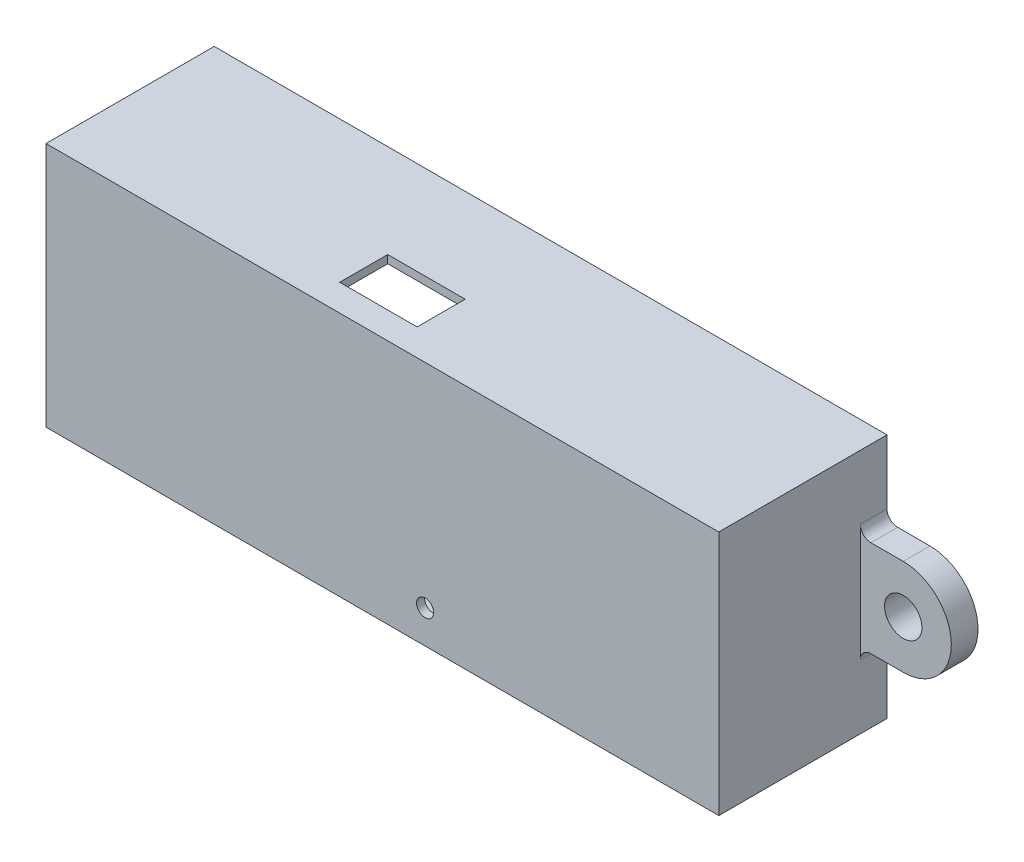
from build123d import *

# Parameters (mm, degrees)
SKETCH_1_W           = 123
SKETCH_1_H           = 43
EXTRUDE_1_DEPTH      = 1.5
EXTRUDE_2_DEPTH      = 30
EXTRUDE_2_DEPTH_BACK = 1.5
SKETCH_2_W           = 126
SKETCH_2_H           = 46
SKETCH_2_W_2         = 123
SKETCH_2_H_2         = 43
SKETCH_3_R           = 3.5
EXTRUDE_3_DEPTH      = 5
SKETCH_5_R           = 1.6
CUT_EXTRUDE_1_DEPTH  = 10
CUT_EXTRUDE_2_DEPTH  = 10
SKETCH_7_W           = 14.5
SKETCH_7_H           = 9
CUT_EXTRUDE_3_DEPTH  = 10
FILLET_1_R           = 2


with BuildPart() as part:
    # Эскиз1 → Бобышка-Вытянуть1 (new body)
    with BuildSketch(Plane.XY):
        with Locations((61.5, 21.5)):
            Rectangle(SKETCH_1_W, SKETCH_1_H)
    extrude(amount=EXTRUDE_1_DEPTH)

    # Эскиз2 → Бобышка-Вытянуть2 (add, two sides: drawn at the far end of the back side and taken through both)
    with BuildSketch(Plane(origin=(0, 0, 0), x_dir=(-1, 0, 0), z_dir=(0, 0, -1)).offset(-EXTRUDE_2_DEPTH_BACK)):
        with Locations((-61.5, 21.5)):
            Rectangle(SKETCH_2_W, SKETCH_2_H)
        with Locations((-61.5, 21.5)):
            Rectangle(SKETCH_2_W_2, SKETCH_2_H_2, mode=Mode.SUBTRACT)
    extrude(amount=EXTRUDE_2_DEPTH + EXTRUDE_2_DEPTH_BACK)

    # Эскиз3 → Бобышка-Вытянуть3 (add)
    with BuildSketch(Plane(origin=(0, 0, -30), x_dir=(-1, 0, 0), z_dir=(0, 0, -1))):
        with BuildLine():
            Line((-124.5, 12.5), (-132.54002612, 12.5))
            ThreePointArc((-132.54002612, 12.5), (-141.54002612, 21.5), (-132.54002612, 30.5))
            Line((-132.54002612, 30.5), (-124.5, 30.5))
            Line((-124.5, 30.5), (-124.5, 12.5))
        make_face()
        with Locations((-132.54002612, 21.5)):
            Circle(SKETCH_3_R, mode=Mode.SUBTRACT)
    extrude_3 = extrude(amount=-EXTRUDE_3_DEPTH)

    # Зеркальное отражение1: Бобышка-Вытянуть3 across plane
    add(extrude_3.mirror(Plane(origin=(61.5, 0, 0), x_dir=(0, 0, 1), z_dir=(1, 0, 0))))

    # Эскиз5 → Вырез-Вытянуть1 (cut)
    with BuildSketch(Plane.XY.offset(1.5)):
        with Locations((69.5, 4.7)):
            Circle(SKETCH_5_R)
    extrude(amount=-CUT_EXTRUDE_1_DEPTH, mode=Mode.SUBTRACT)

    # Эскиз6 → Вырез-Вытянуть2 (cut)
    with BuildSketch(Plane.ZY.offset(1.5)):
        Polygon((-20, 17.3), (-22.5, 17.3), (-25, 17.3), (-25, 16.65), (-25, 9.65), (-25, 8.5), (-22.5, 8.5), (-20, 8.5), align=None)
    extrude(amount=-CUT_EXTRUDE_2_DEPTH, mode=Mode.SUBTRACT)

    # Эскиз7 → Вырез-Вытянуть3 (cut)
    with BuildSketch(Plane(origin=(0, 44.5, 0), x_dir=(1, 0, 0), z_dir=(0, 1, 0))):
        with Locations((55.75, 8)):
            Rectangle(SKETCH_7_W, SKETCH_7_H)
    extrude(amount=-CUT_EXTRUDE_3_DEPTH, mode=Mode.SUBTRACT)

    # Скругление1
    fillet_1_edges = [part.edges().sort_by_distance(p)[0] for p in [
        (124.5, 30.5, -27.5),
        (124.5, 12.5, -27.5),
        (-1.5, 12.5, -27.5),
        (-1.5, 30.5, -27.5),
    ]]
    fillet(fillet_1_edges, radius=FILLET_1_R)


solid = part.part
